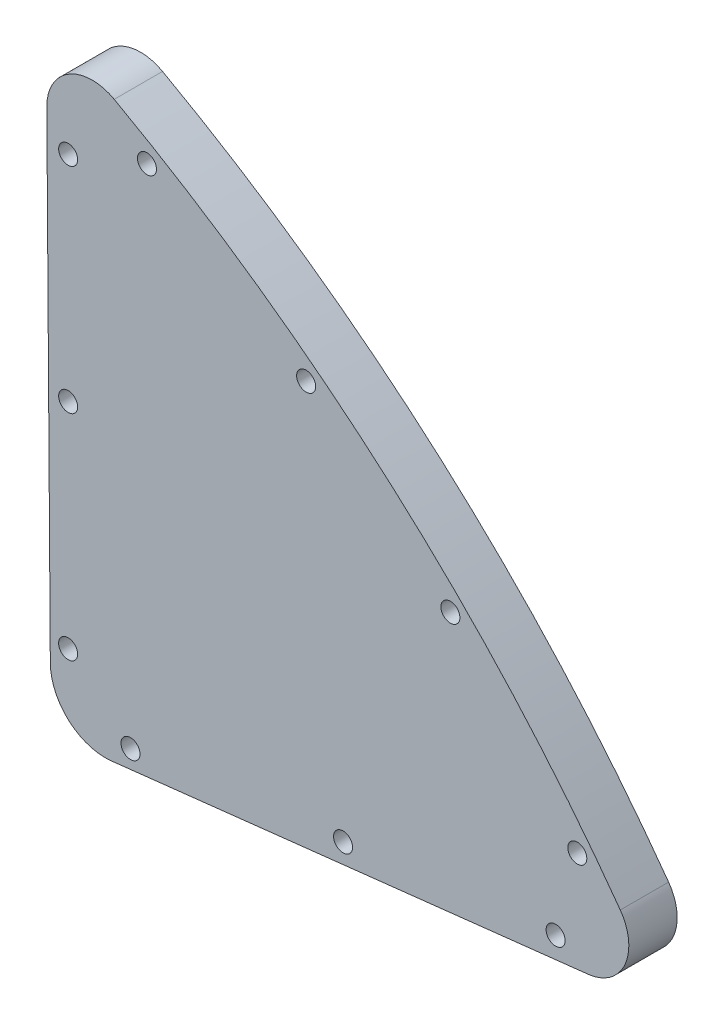
from build123d import *

# Parameters (mm, degrees)
BOSS_EXTRUDE1_DEPTH = 12.7
SKETCH2_R           = 2.5
CUT_EXTRUDE1_DEPTH  = 188.024650501


with BuildPart() as part:
    # Sketch1 → Boss-Extrude1 (new body)
    with BuildSketch(Plane.XY):
        with BuildLine():
            Line((0.928877391, -25.603544091), (126.263071952, -11.506498815))
            ThreePointArc((126.263071952, -11.506498815), (135.842076702, -4.482224693), (134.616347537, 7.332822786))
            ThreePointArc((134.616347537, 7.332822786), (74.665711789, 73.710136722), (1.625549575, 125.335336338))
            ThreePointArc((1.625549575, 125.335336338), (-10.25140355, 125.146277033), (-16.085786649, 114.799406357))
            Line((-16.085786649, 114.799406357), (-15.166957214, -11.321736852))
            ThreePointArc((-15.166957214, -11.321736852), (-10.298375042, -22.045804112), (0.928877391, -25.603544091))
        make_face()
    extrude(amount=BOSS_EXTRUDE1_DEPTH)

    # Sketch2 → Cut-Extrude1 (cut, through all)
    with BuildSketch(Plane(origin=(0, 0, 0), x_dir=(-1, 0, 0), z_dir=(0, 0, -1))):
        with Locations((10.480661871, 106.771257069)):
            Circle(SKETCH2_R)
        with Locations((10.480661871, 50.510257069)):
            Circle(SKETCH2_R)
        with Locations((10.480661871, -5.750742931)):
            Circle(SKETCH2_R)
        with Locations((-52.065748574, 86.409889957)):
            Circle(SKETCH2_R)
        with Locations(Location((-89.964774668, 52.78214722, 0), (0, 0, 180))):
            Circle(SKETCH2_R)
        with Locations(Location((-123.32009462, 14.643139741, 0), (0, 0, 180))):
            Circle(SKETCH2_R)
        with Locations((-10.228252117, 114.989343254)):
            Circle(SKETCH2_R)
        with Locations(Location((-117.624924608, -6.89661647, 0), (0, 0, 180))):
            Circle(SKETCH2_R)
        with Locations(Location((-61.763750637, -13.592089836, 0), (0, 0, 180))):
            Circle(SKETCH2_R)
        with Locations(Location((-5.902576666, -20.287563201, 0), (0, 0, 180))):
            Circle(SKETCH2_R)
    extrude(amount=-CUT_EXTRUDE1_DEPTH, mode=Mode.SUBTRACT)


solid = part.part
